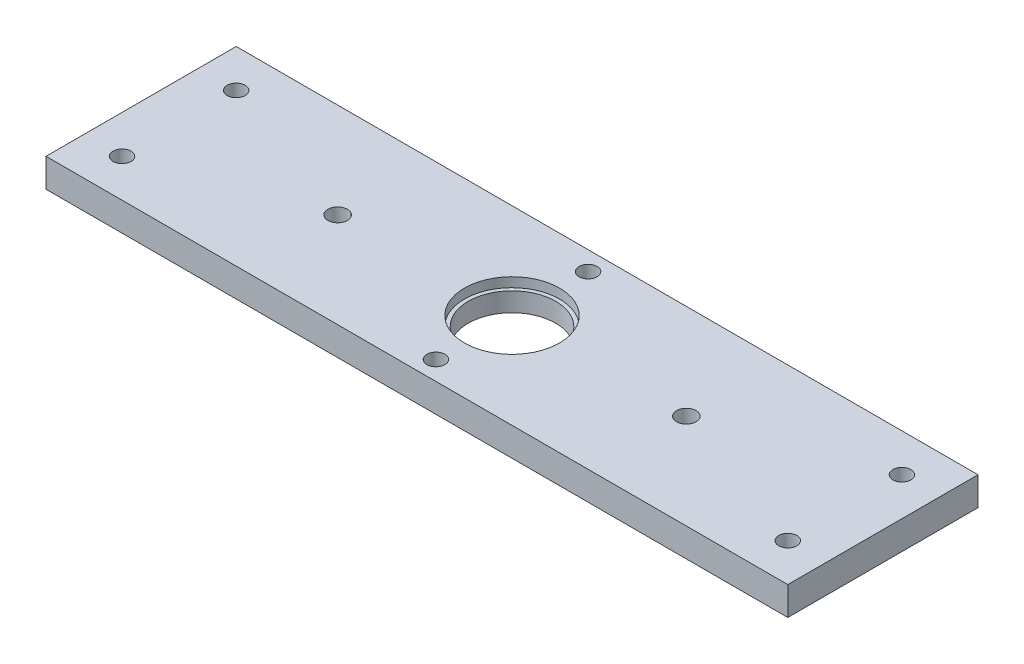
from build123d import *

# Parameters (mm, degrees)
SKETCH1_W                  = 247.65
SKETCH1_H                  = 63.5
BOSS_EXTRUDE1_DEPTH        = 9.525
SKETCH3_R                  = 14.605
CUT_EXTRUDE1_DEPTH         = 129.185095662
F_6_0_6_DIAMETER_HOLE1_D   = 6
F_6_5_6_5_DIAMETER_HOLE3_D = 6.5
SKETCH29_R                 = 15.875
CUT_EXTRUDE5_DEPTH         = 3.175
F_6_0_6_DIAMETER_HOLE3_D   = 6


with BuildPart() as part:
    # Sketch1 → Boss-Extrude1 (new body)
    with BuildSketch(Plane(origin=(0, 0, 0), x_dir=(1, 0, 0), z_dir=(0, 1, 0))):
        Rectangle(SKETCH1_W, SKETCH1_H)
    extrude(amount=BOSS_EXTRUDE1_DEPTH)

    # Sketch3 → Cut-Extrude1 (cut, through all)
    with BuildSketch(Plane(origin=(0, 9.525, 0), x_dir=(1, 0, 0), z_dir=(0, 1, 0))):
        with Locations(Location((0, 0, 0), (0, 0, 270))):
            Circle(SKETCH3_R)
    extrude(amount=-CUT_EXTRUDE1_DEPTH, mode=Mode.SUBTRACT)

    # Ø6.0 (6) Diameter Hole1 (through all)
    with Locations(Plane(origin=(0, 0, 0), x_dir=(-1, 0, 0), z_dir=(0, -1, 0))):
        with Locations((0, -25.4), (0, 25.4)):
            Hole(F_6_0_6_DIAMETER_HOLE1_D / 2)

    # Ø6.5 (6.5) Diameter Hole3 (through all)
    with Locations(Plane(origin=(0, 0, 0), x_dir=(-1, 0, 0), z_dir=(0, -1, 0))):
        with Locations((58.208333333, 0), (-58.208333333, 0)):
            Hole(F_6_5_6_5_DIAMETER_HOLE3_D / 2)

    # Sketch29 → Cut-Extrude5 (cut)
    with BuildSketch(Plane(origin=(0, 9.525, 0), x_dir=(1, 0, 0), z_dir=(0, 1, 0))):
        with Locations(Location((0, 0, 0), (0, 0, 270))):
            Circle(SKETCH29_R)
    extrude(amount=-CUT_EXTRUDE5_DEPTH, mode=Mode.SUBTRACT)

    # Ø6.0 (6) Diameter Hole3 (through all)
    with Locations(Plane(origin=(0, 9.525, 0), x_dir=(1, 0, 0), z_dir=(0, 1, 0))):
        with Locations((-111.125, 19.05), (-111.125, -19.05), (111.125, -19.05), (111.125, 19.05)):
            Hole(F_6_0_6_DIAMETER_HOLE3_D / 2)


solid = part.part
